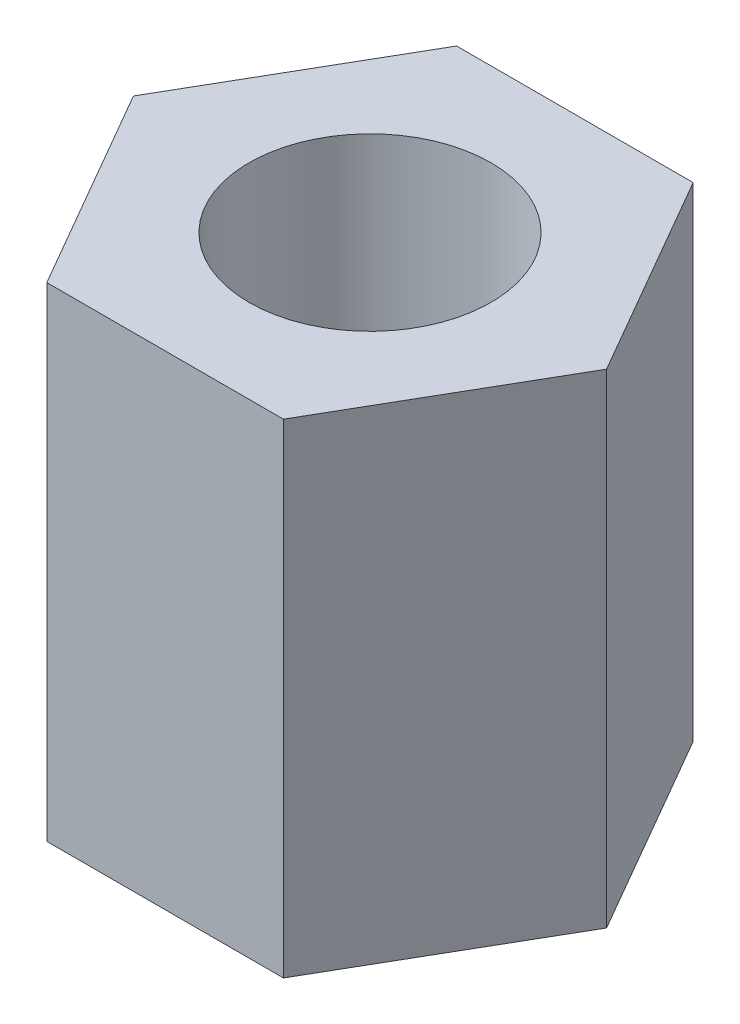
from build123d import *

# Parameters (mm, degrees)
SKETCH1_R           = 1.5
BOSS_EXTRUDE1_DEPTH = 6


with BuildPart() as part:
    # Sketch1 → Boss-Extrude1 (new body)
    with BuildSketch(Plane(origin=(0, 0, 0), x_dir=(1, 0, 0), z_dir=(0, 1, 0))):
        Polygon((1.466469684, 2.54), (-1.466469684, 2.54), (-2.932939367, 0), (-1.466469684, -2.54), (1.466469684, -2.54), (2.932939367, 0), align=None)
        with Locations(Location((0, 0, 0), (0, 0, 270))):
            Circle(SKETCH1_R, mode=Mode.SUBTRACT)
    extrude(amount=BOSS_EXTRUDE1_DEPTH)


solid = part.part
